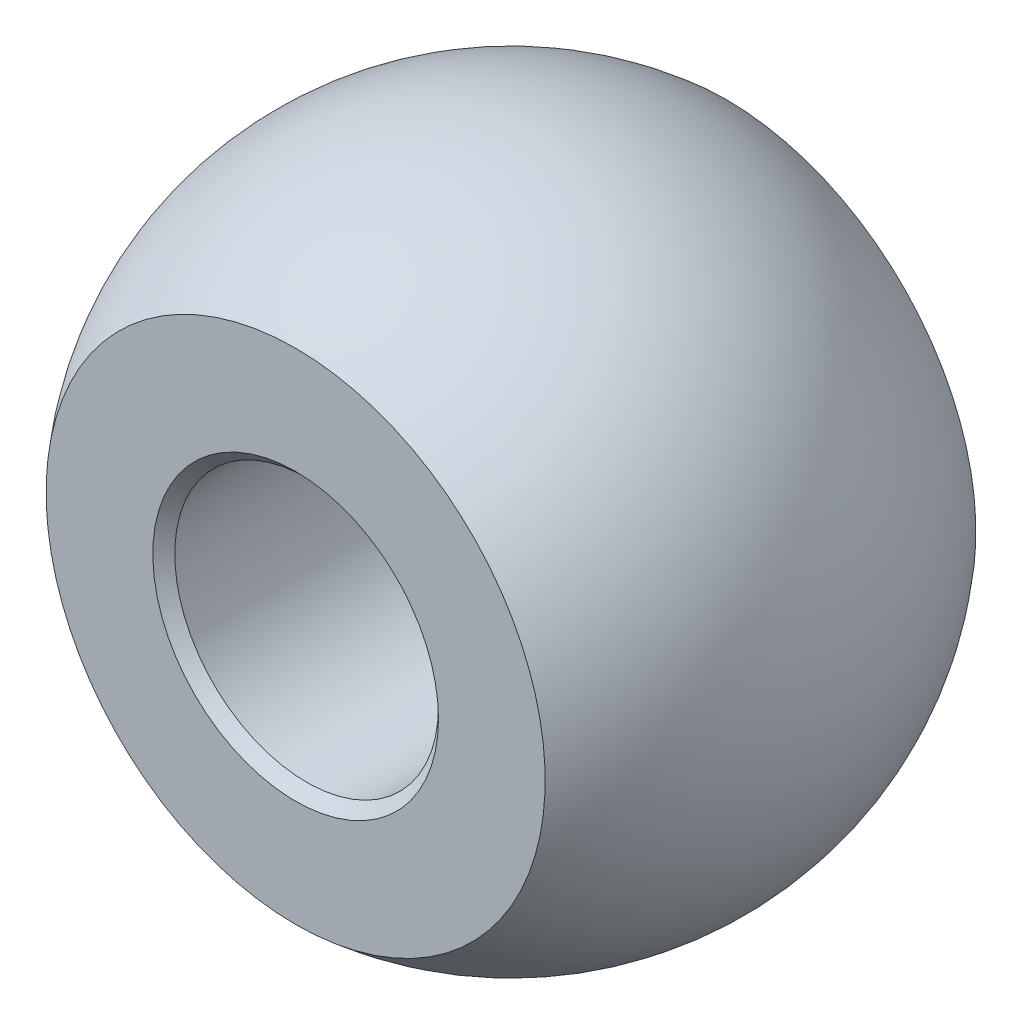
from build123d import *

# Parameters (mm, degrees)
CUT_EXTRUDE1_DEPTH      = 10.185586535
CUT_EXTRUDE1_DEPTH_BACK = 10.185586535
SKETCH2_W               = 2
SKETCH2_H               = 7.6
CUT_EXTRUDE2_DEPTH      = 11.428446672
CUT_EXTRUDE2_DEPTH_BACK = 11.428446672
SKETCH3_R               = 1.5
CHAMFER1_SIZE           = 0.125


with BuildPart() as part:
    # Sketch1 → Revolve1 (revolve)
    with BuildSketch(Plane.XY):
        with BuildLine():
            Line((0, 0), (0, 7.5))
            ThreePointArc((0, 7.5), (3.75, 3.75), (0, 0))
        make_face()
    revolve(axis=Axis((0, 0, 0), (0, 1, 0)))

    # Sketch2 → Cut-Extrude1 (cut, two sides: drawn at the far end of the back side and taken through both)
    with BuildSketch(Plane(origin=(0, 0, 0), x_dir=(0, 0, -1), z_dir=(1, 0, 0)).offset(-CUT_EXTRUDE1_DEPTH_BACK)):
        with Locations((-3.45, 3.8)):
            Rectangle(SKETCH2_W, SKETCH2_H)
        with Locations((3.45, 3.8)):
            Rectangle(SKETCH2_W, SKETCH2_H)
    extrude(amount=CUT_EXTRUDE1_DEPTH + CUT_EXTRUDE1_DEPTH_BACK, mode=Mode.SUBTRACT)

    # Sketch3 → Cut-Extrude2 (cut, two sides: drawn at the far end of the back side and taken through both)
    with BuildSketch(Plane.XY.offset(2.45).offset(-CUT_EXTRUDE2_DEPTH_BACK)):
        with Locations((0, 3.75)):
            Circle(SKETCH3_R)
    extrude(amount=CUT_EXTRUDE2_DEPTH + CUT_EXTRUDE2_DEPTH_BACK, mode=Mode.SUBTRACT)

    # Chamfer1
    chamfer1_edges = [part.edges().sort_by_distance(p)[0] for p in [
        (-1.5, 3.75, -2.45),
        (-1.5, 3.75, 2.45),
    ]]
    chamfer(chamfer1_edges, length=CHAMFER1_SIZE)


solid = part.part
